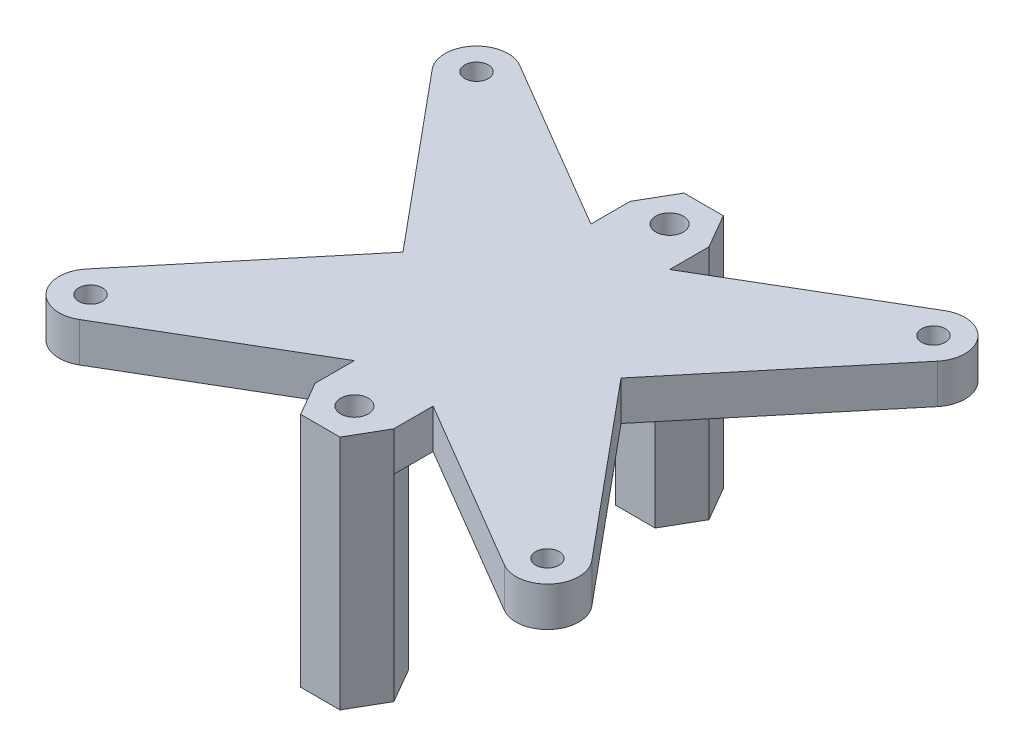
from build123d import *

# Parameters (mm, degrees)
BOSS_EXTRU_1_DEPTH      = 5
ESQUISSE2_R             = 1.5
ENL_V_MAT_EXTRU_2_DEPTH = 5
ESQUISSE4_R             = 1.75
BOSS_EXTRU_6_DEPTH      = 5
BOSS_EXTRU_7_START      = 14.5
ESQUISSE4_3_R           = 1.75
BOSS_EXTRU_7_DEPTH      = 14.5
BOSS_EXTRU_8_DEPTH      = 2.5
BOSS_EXTRU_10_START     = 25
ESQUISSE4_6_R           = 1.75
BOSS_EXTRU_10_DEPTH     = 8


with BuildPart() as part:
    # Esquisse1 → Boss.-Extru.1 (new body)
    with BuildSketch(Plane(origin=(0, 0, 0), x_dir=(1, 0, 0), z_dir=(0, 1, 0))):
        with BuildLine():
            ThreePointArc((-26.971076335, 27.947240746), (-32.047229987, 27.091213887), (-32.076386522, 21.943469936))
            Line((-32.076386522, 21.943469936), (-13.840985932, 0))
            Line((-13.840985932, 0), (-32.076386522, -21.943469936))
            ThreePointArc((-32.076386522, -21.943469936), (-32.047229987, -27.091213887), (-26.971076335, -27.947240746))
            Line((-26.971076335, -27.947240746), (0, -12.073021601))
            Line((0, -12.073021601), (26.971076335, -27.947240746))
            ThreePointArc((26.971076335, -27.947240746), (32.047229987, -27.091213887), (32.076386522, -21.943469936))
            Line((32.076386522, -21.943469936), (13.840985932, 0))
            Line((13.840985932, 0), (32.076386522, 21.943469936))
            ThreePointArc((32.076386522, 21.943469936), (32.047229987, 27.091213887), (26.971076335, 27.947240746))
            Line((26.971076335, 27.947240746), (0, 12.073021601))
            Line((0, 12.073021601), (-26.971076335, 27.947240746))
        make_face()
    extrude(amount=BOSS_EXTRU_1_DEPTH)

    # Esquisse2 → Enlèv. mat.-Extru.2 (cut)
    with BuildSketch(Plane(origin=(0, 5, 0), x_dir=(1, 0, 0), z_dir=(0, 1, 0))):
        with Locations((-29, 24.5)):
            Circle(ESQUISSE2_R)
        with Locations((29, 24.5)):
            Circle(ESQUISSE2_R)
        with Locations((29, -24.5)):
            Circle(ESQUISSE2_R)
        with Locations((-29, -24.5)):
            Circle(ESQUISSE2_R)
    extrude(amount=-ENL_V_MAT_EXTRU_2_DEPTH, mode=Mode.SUBTRACT)

    # Esquisse4 → Boss.-Extru.6 (add)
    # profile 1 of 2: a face of its own
    with BuildSketch(Plane.XZ):
        Polygon((5, 15.015844303), (5, 20), (2.5, 24.330127019), (-2.5, 24.330127019), (-5, 20), (-5, 15.015844303), (0, 12.073021601), align=None)
        with Locations((0, 20)):
            Circle(ESQUISSE4_R, mode=Mode.SUBTRACT)
    # profile 2 of 2: a face of its own
    with BuildSketch(Plane.XZ):
        Polygon((2.5, -24.330127019), (5, -20), (5, -15.015844303), (0, -12.073021601), (-5, -15.015844303), (-5, -20), (-2.5, -24.330127019), align=None)
        with Locations((0, -20)):
            Circle(ESQUISSE4_R, mode=Mode.SUBTRACT)
    extrude(amount=-BOSS_EXTRU_6_DEPTH)

    # Esquisse4<3> → Boss.-Extru.7 (add)
    # profile 1 of 2: a face of its own
    with BuildSketch(Plane.XZ.offset(BOSS_EXTRU_7_START)):
        Polygon((-2.5, 24.330127019), (-5, 20), (-2.5, 15.669872981), (2.5, 15.669872981), (5, 20), (2.5, 24.330127019), align=None)
        with Locations((0, 20)):
            Circle(ESQUISSE4_3_R, mode=Mode.SUBTRACT)
    # profile 2 of 2: a face of its own
    with BuildSketch(Plane.XZ.offset(BOSS_EXTRU_7_START)):
        Polygon((2.5, -24.330127019), (5, -20), (2.5, -15.669872981), (-2.5, -15.669872981), (-5, -20), (-2.5, -24.330127019), align=None)
        with Locations((0, -20)):
            Circle(ESQUISSE4_3_R, mode=Mode.SUBTRACT)
    extrude(amount=-BOSS_EXTRU_7_DEPTH)

    # Esquisse5 → Boss.-Extru.8 (add)
    # profile 1 of 2: a face of its own
    with BuildSketch(Plane.XZ.offset(14.5)):
        Polygon((5, 20), (2.5, 24.330127019), (-2.5, 24.330127019), (-5, 20), (-2.5, 15.669872981), (2.5, 15.669872981), align=None)
        Polygon((2.886751346, 20), (1.443375673, 22.5), (-1.443375673, 22.5), (-2.886751346, 20), (-1.443375673, 17.5), (1.443375673, 17.5), align=None, mode=Mode.SUBTRACT)
    # profile 2 of 2: a face of its own
    with BuildSketch(Plane.XZ.offset(14.5)):
        Polygon((5, -20), (2.5, -15.669872981), (-2.5, -15.669872981), (-5, -20), (-2.5, -24.330127019), (2.5, -24.330127019), align=None)
        Polygon((3.175426481, -20), (1.58771324, -17.25), (-1.58771324, -17.25), (-3.175426481, -20), (-1.58771324, -22.75), (1.58771324, -22.75), align=None, mode=Mode.SUBTRACT)
    extrude(amount=BOSS_EXTRU_8_DEPTH)

    # Esquisse4<6> → Boss.-Extru.10 (add)
    # profile 1 of 2: a face of its own
    with BuildSketch(Plane.XZ.offset(BOSS_EXTRU_10_START)):
        Polygon((-2.5, 24.330127019), (-5, 20), (-2.5, 15.669872981), (2.5, 15.669872981), (5, 20), (2.5, 24.330127019), align=None)
        with Locations((0, 20)):
            Circle(ESQUISSE4_6_R, mode=Mode.SUBTRACT)
    # profile 2 of 2: a face of its own
    with BuildSketch(Plane.XZ.offset(BOSS_EXTRU_10_START)):
        Polygon((2.5, -24.330127019), (5, -20), (2.5, -15.669872981), (-2.5, -15.669872981), (-5, -20), (-2.5, -24.330127019), align=None)
        with Locations((0, -20)):
            Circle(ESQUISSE4_6_R, mode=Mode.SUBTRACT)
    extrude(amount=-BOSS_EXTRU_10_DEPTH)


solid = part.part
